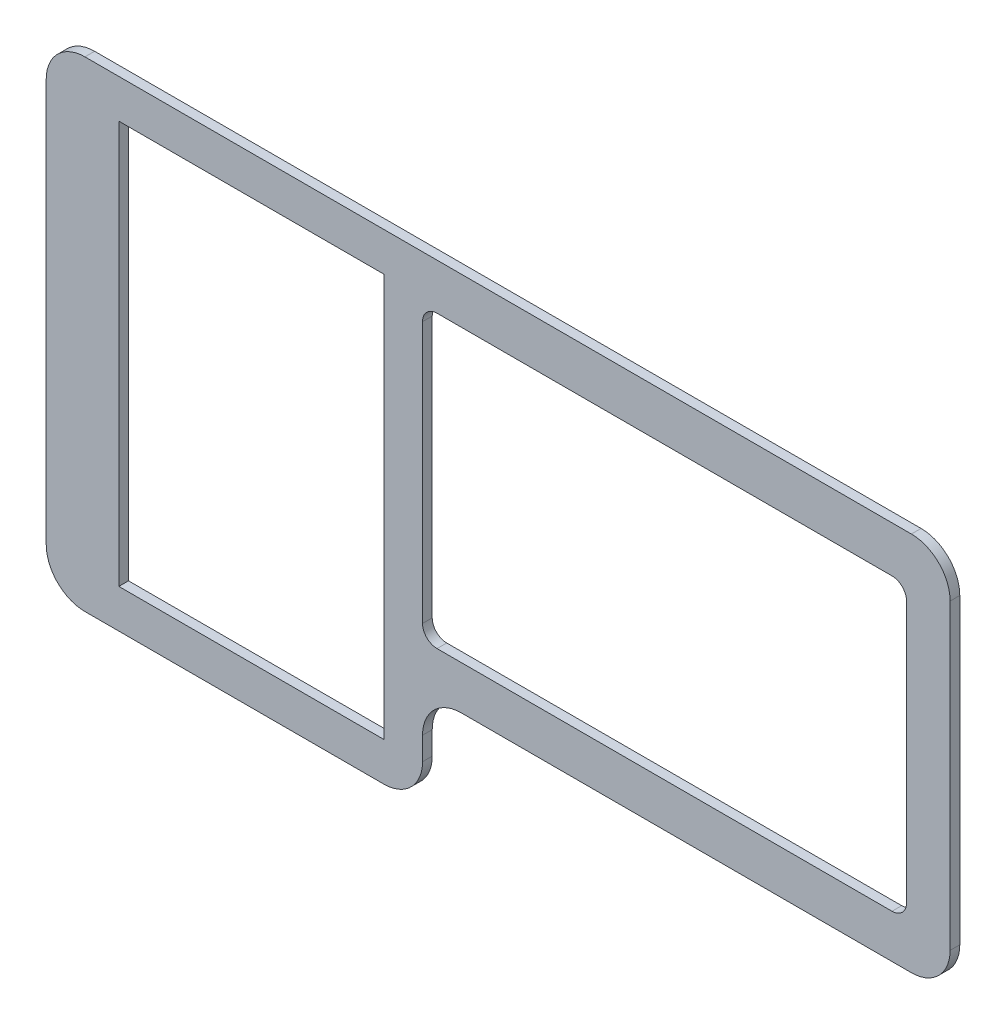
from build123d import *

# Parameters (mm, degrees)
SKETCH1_W          = 54.75
SKETCH1_H          = 83.25
MAIN_EXTRUDE_DEPTH = 2


with BuildPart() as part:
    # Sketch1 → Main extrude (new body)
    with BuildSketch(Plane.XY):
        with BuildLine():
            Line((-50, -51.75), (-50, -47))
            ThreePointArc((-50, -47), (-47.656854249, -41.343145751), (-42, -39))
            Line((-42, -39), (51, -39))
            ThreePointArc((51, -39), (56.656854249, -36.656854249), (59, -31))
            Line((59, -31), (59, 31.5))
            ThreePointArc((59, 31.5), (56.656854249, 37.156854249), (51, 39.5))
            Line((51, 39.5), (-119.75, 39.5))
            ThreePointArc((-119.75, 39.5), (-125.406854249, 37.156854249), (-127.75, 31.5))
            Line((-127.75, 31.5), (-127.75, -51.75))
            ThreePointArc((-127.75, -51.75), (-125.406854249, -57.406854249), (-119.75, -59.75))
            Line((-119.75, -59.75), (-58, -59.75))
            ThreePointArc((-58, -59.75), (-52.343145751, -57.406854249), (-50, -51.75))
        make_face()
        with BuildLine():
            Line((-47, 30), (47, 30))
            ThreePointArc((47, 30), (49.121320344, 29.121320344), (50, 27))
            Line((50, 27), (50, -27))
            ThreePointArc((50, -27), (49.121320344, -29.121320344), (47, -30))
            Line((47, -30), (-47, -30))
            ThreePointArc((-47, -30), (-49.121320344, -29.121320344), (-50, -27))
            Line((-50, -27), (-50, 27))
            ThreePointArc((-50, 27), (-49.121320344, 29.121320344), (-47, 30))
        make_face(mode=Mode.SUBTRACT)
        with Locations((-85.375, -10.125)):
            Rectangle(SKETCH1_W, SKETCH1_H, mode=Mode.SUBTRACT)
    extrude(amount=MAIN_EXTRUDE_DEPTH)


solid = part.part
